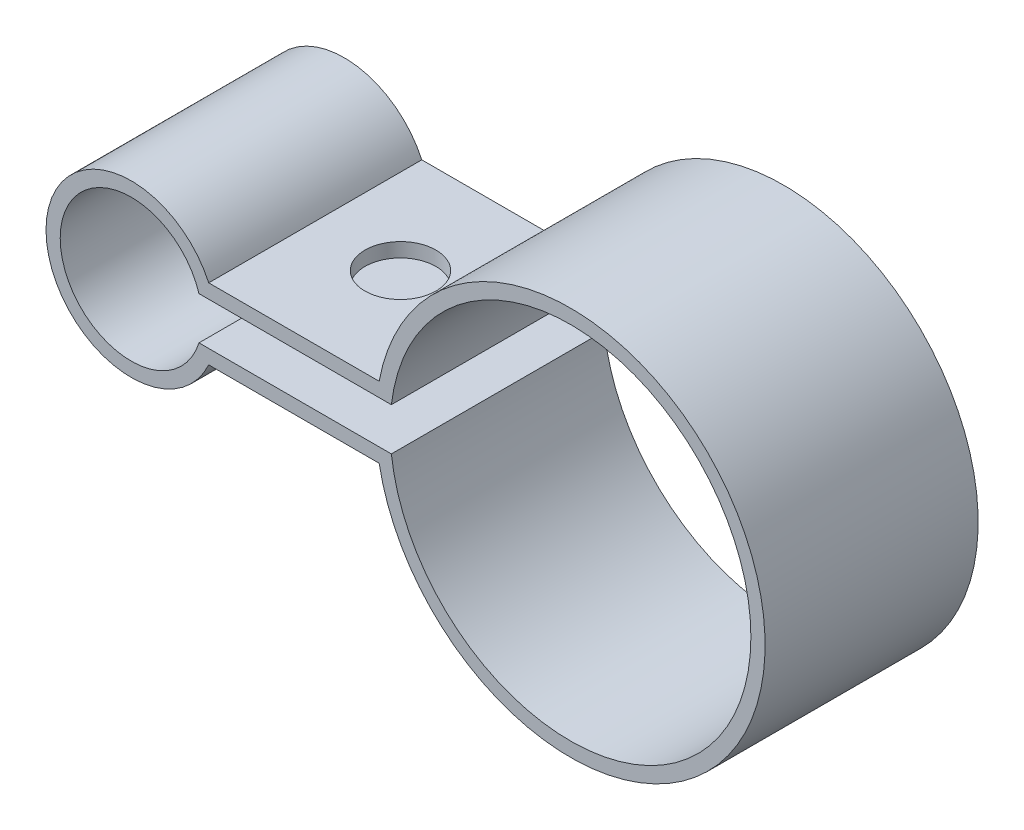
from build123d import *

# Parameters (mm, degrees)
SALIENTE_EXTRUIR1_DEPTH = 15
CROQUIS2_R              = 2.5
CORTAR_EXTRUIR1_DEPTH   = 15


with BuildPart() as part:
    # Croquis1 → Saliente-Extruir1 (new body)
    with BuildSketch(Plane.XY):
        with BuildLine():
            Line((5.454356057, 2.5), (17.454356057, 2.5))
            ThreePointArc((17.454356057, 2.5), (44.62432265, 0), (17.454356057, -2.5))
            Line((17.454356057, -2.5), (13.54145622, -2.5))
            Line((13.54145622, -2.5), (9.54145622, -2.5))
            Line((9.54145622, -2.5), (5.454356057, -2.5))
            ThreePointArc((5.454356057, -2.5), (-6, 0), (5.454356057, 2.5))
        make_face()
        with BuildLine():
            Line((4.769696007, 1.5), (18.313216433, 1.5))
            ThreePointArc((18.313216433, 1.5), (43.62432265, 0), (18.313216433, -1.5))
            Line((18.313216433, -1.5), (13.54145622, -1.5))
            Line((13.54145622, -1.5), (9.54145622, -1.5))
            Line((9.54145622, -1.5), (4.769696007, -1.5))
            ThreePointArc((4.769696007, -1.5), (-5, 0), (4.769696007, 1.5))
        make_face(mode=Mode.SUBTRACT)
    extrude(amount=SALIENTE_EXTRUIR1_DEPTH)

    # Croquis2 → Cortar-Extruir1 (cut)
    with BuildSketch(Plane(origin=(0, 2.5, 0), x_dir=(1, 0, 0), z_dir=(0, 1, 0))):
        with Locations(Location((11.454356057, -7.5, 0), (0, 0, 270))):
            Circle(CROQUIS2_R)
    extrude(amount=-CORTAR_EXTRUIR1_DEPTH, mode=Mode.SUBTRACT)


solid = part.part
